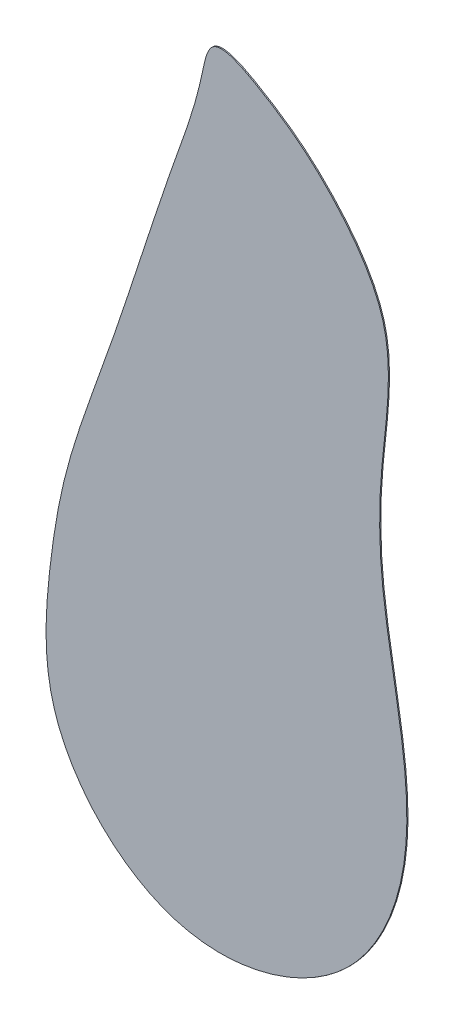
from build123d import *

# Parameters (mm, degrees)
BOSS_EXTRUDE2_DEPTH = 0.5


with BuildPart() as part:
    # Sketch1 → Boss-Extrude2 (new body)
    with BuildSketch(Plane.XY):
        with BuildLine():
            add(Edge.make_bspline(
                [(391.933748398, 73.459596677), (381.81319486, 72.241162361), (346.886712079, 74.780729827), (302.854619518, 119.339422242), (305.804854102, 176.828862541), (313.635612554, 226.691754566), (337.050301626, 287.273657201), (356.620781119, 351.854437008), (372.908340706, 394.806846171), (378.017146459, 424.56322185), (408.515877567, 408.56489974), (431.753334074, 389.836201906), (455.038328645, 359.534046433), (458.083027782, 324.715319247), (452.879284065, 293.09580235), (452.804543922, 251.444009302), (461.97184454, 204.23489394), (469.231718022, 149.594063298), (446.513636093, 93.064031656), (410.143996473, 75.651966004), (391.933748398, 73.459596677)],
                knots=[0, 0, 0, 0, 0.036613799, 0.124982615, 0.190634867, 0.239129538, 0.30896775, 0.427420168, 0.475732657, 0.491842951, 0.517228178, 0.564938993, 0.619604188, 0.643342874, 0.690632661, 0.735886277, 0.794018657, 0.865769386, 0.934119576, 1, 1, 1, 1], degree=3))
        make_face()
    extrude(amount=BOSS_EXTRUDE2_DEPTH)


solid = part.part
